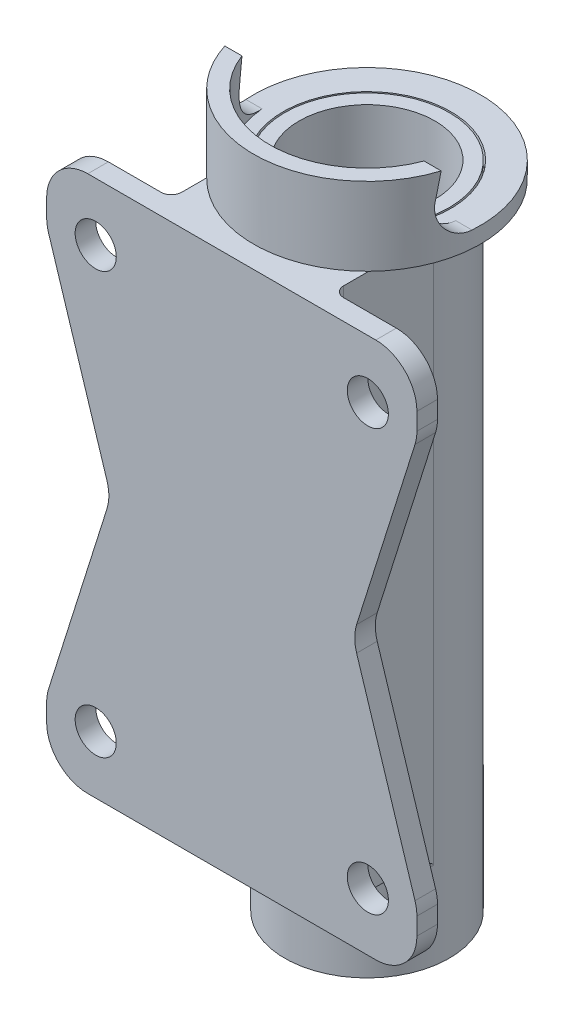
from build123d import *
from build123d.topology import SkipClean

# Parameters (mm, degrees)
BOSS_EXTRUDE1_DEPTH      = 3.175
BOSS_EXTRUDE4_START      = 150.025
BOSS_EXTRUDE4_DEPTH      = 150.025
BOSS_EXTRUDE5_START      = 3.175
BOSS_EXTRUDE5_DEPTH      = 3.175
SKETCH18_W               = 114.3
SKETCH18_H               = 173.2
BOSS_EXTRUDE6_DEPTH      = 6.35
BOSS_EXTRUDE9_DEPTH      = 1.5875
BOSS_EXTRUDE9_DEPTH_BACK = 1.5875
SKETCH26_R               = 35
SKETCH26_R_2             = 25.899999994
BOSS_EXTRUDE7_DEPTH      = 5
BOSS_EXTRUDE8_DEPTH      = 19.05
CUT_EXTRUDE3_DEPTH       = 231.866297886
CUT_EXTRUDE3_DEPTH_BACK  = 231.866297886
BOSS_EXTRUDE10_START     = 150.025
BOSS_EXTRUDE10_DEPTH     = 150.025
BOSS_EXTRUDE11_START     = 9.325
BOSS_EXTRUDE11_DEPTH     = 9.325
SKETCH36_W               = 6.35
SKETCH36_H               = 7.5
CUT_EXTRUDE4_DEPTH       = 252.192386516
FILLET1_R                = 3.175
CUT_EXTRUDE5_DEPTH       = 238.723253055
FILLET2_R                = 12.7
SKETCH38_R               = 6.35
CUT_EXTRUDE6_DEPTH       = 238.723253055
SKETCH41_R               = 25.399999994
CUT_EXTRUDE8_DEPTH       = 213.813709708


with BuildPart() as part:
    # Sketch12 → Revolve1 (revolve)
    with BuildSketch(Plane.XY, mode=Mode.PRIVATE) as revolve1_sk:
        Polygon((-25.399999994, 0), (-25.399999994, 203.2), (-20.955, 203.2), (-20.955, 165.1), (-19.177, 165.1), (-19.177, 38.1), (-20.955, 38.1), (-20.955, 0), align=None)
    revolve(revolve1_sk.sketch.rotate(Axis((0, 0, 0), (0, 1, 0)), 270), axis=Axis((0, 0, 0), (0, 1, 0)))



with BuildPart() as body_2:
    # Sketch14 → Boss-Extrude1 (new body)
    with BuildSketch(Plane(origin=(0, 30, 0), x_dir=(-1, 0, 0), z_dir=(0, -1, 0))):
        with BuildLine():
            Line((-25, -4.489988829), (-25, -35.399999994))
            Line((-25, -35.399999994), (25, -35.399999994))
            Line((25, -35.399999994), (25, -4.489988829))
            ThreePointArc((25, -4.489988829), (0, -25.399999994), (-25, -4.489988829))
        make_face()
    extrude(amount=-BOSS_EXTRUDE1_DEPTH)

    # Sketch15 → Boss-Extrude4 (add)
    with BuildSketch(Plane(origin=(0, 33.175, 0), x_dir=(1, 0, 0), z_dir=(0, 1, 0)).offset(BOSS_EXTRUDE4_START)):
        with BuildLine():
            Line((-1.5875, -25.350342077), (-1.5875, -35.399999994))
            Line((-1.5875, -35.399999994), (1.5875, -35.399999994))
            Line((1.5875, -35.399999994), (1.5875, -25.350342077))
            ThreePointArc((1.5875, -25.350342077), (0, -25.399999994), (-1.5875, -25.350342077))
        make_face()
    extrude(amount=-BOSS_EXTRUDE4_DEPTH)

    # Sketch17 → Boss-Extrude5 (add)
    with BuildSketch(Plane(origin=(0, 183.2, 0), x_dir=(1, 0, 0), z_dir=(0, 1, 0)).offset(BOSS_EXTRUDE5_START)):
        with BuildLine():
            Line((25, -35.399999994), (25, -4.489988829))
            ThreePointArc((25, -4.489988829), (0, -25.399999994), (-25, -4.489988829))
            Line((-25, -4.489988829), (-25, -35.399999994))
            Line((-25, -35.399999994), (25, -35.399999994))
        make_face()
    extrude(amount=-BOSS_EXTRUDE5_DEPTH)

    # Sketch18 → Boss-Extrude6 (add)
    with BuildSketch(Plane.XY.offset(35.399999994)):
        with Locations((0, 116.6)):
            Rectangle(SKETCH18_W, SKETCH18_H)
    extrude(amount=BOSS_EXTRUDE6_DEPTH)


with BuildPart() as part_1:
    add(part.part)

    add(body_2.part)  # Boss-Extrude9 merges body 2
    # Sketch30 → Boss-Extrude9 (add, two sides: drawn at the far end of the back side and taken through both)
    with BuildSketch(Plane(origin=(0, 106.6, 0), x_dir=(-1, 0, 0), z_dir=(0, -1, 0)).offset(-BOSS_EXTRUDE9_DEPTH_BACK)):
        with BuildLine():
            Line((25, -35.399999994), (25, -4.489988829))
            ThreePointArc((25, -4.489988829), (0, -25.399999994), (-25, -4.489988829))
            Line((-25, -4.489988829), (-25, -35.399999994))
            Line((-25, -35.399999994), (25, -35.399999994))
        make_face()
    extrude(amount=BOSS_EXTRUDE9_DEPTH + BOSS_EXTRUDE9_DEPTH_BACK)


with BuildPart() as body_2_2:
    # Sketch26 → Boss-Extrude7 (new body)
    with BuildSketch(Plane(origin=(0, 200.7, 0), x_dir=(1, 0, 0), z_dir=(0, 1, 0))):
        with Locations(Location((0, 0, 0), (0, 0, 270))):
            Circle(SKETCH26_R)
        with Locations(Location((0, 0, 0), (0, 0, 270))):
            Circle(SKETCH26_R_2, mode=Mode.SUBTRACT)
    extrude(amount=-BOSS_EXTRUDE7_DEPTH)

    # Sketch26<3> → Boss-Extrude8 (add)
    with SkipClean():  # the faces are left unmerged after this step: merging them gives an invalid solid
        with BuildSketch(Plane(origin=(0, 200.7, 0), x_dir=(1, 0, 0), z_dir=(0, 1, 0))):
            with BuildLine():
                ThreePointArc((-34.910600109, -2.5), (0, -35), (34.910600109, -2.5))
                Line((34.910600109, -2.5), (29.895651858, -2.5))
                ThreePointArc((29.895651858, -2.5), (0, -30), (-29.895651858, -2.5))
                Line((-29.895651858, -2.5), (-34.910600109, -2.5))
            make_face()
        extrude(amount=BOSS_EXTRUDE8_DEPTH)


with BuildPart() as cut_extrude3_tool:
    # Sketch33 → Cut-Extrude3 (new, two sides: drawn at the far end of the back side and taken through both)
    with SkipClean():  # the faces are left unmerged after this step: merging them gives an invalid solid
        with BuildSketch(Plane(origin=(0, 0, 0), x_dir=(0, 0, -1), z_dir=(1, 0, 0)).offset(-CUT_EXTRUDE3_DEPTH_BACK)):
            with BuildLine():
                Line((-2.5, 219.75), (-2.99214107, 219.75))
                Line((-2.99214107, 219.75), (-10.5, 219.75))
                Line((-10.5, 219.75), (-11.8865543, 211.886459809))
                ThreePointArc((-11.8865543, 211.886459809), (-9.801443088, 204.104718827), (-2.5, 200.7))
                Line((-2.5, 200.7), (-2.5, 219.75))
            make_face()
        extrude(amount=CUT_EXTRUDE3_DEPTH + CUT_EXTRUDE3_DEPTH_BACK)


with BuildPart() as part_2:
    with SkipClean():  # the faces are left unmerged after this step: merging them gives an invalid solid
        add(part_1.part)

        # Cut-Extrude3: cut by cut_extrude3_tool
        add(cut_extrude3_tool.part, mode=Mode.SUBTRACT)

    # Sketch34 → Boss-Extrude10 (add)
    with BuildSketch(Plane(origin=(0, 33.175, 0), x_dir=(1, 0, 0), z_dir=(0, 1, 0)).offset(BOSS_EXTRUDE10_START)):
        with BuildLine():
            Line((-25, -35.399999994), (-1.5875, -35.399999994))
            Line((-1.5875, -35.399999994), (-1.5875, -25.350342077))
            ThreePointArc((-1.5875, -25.350342077), (-16.897111394, -18.964377823), (-25, -4.489988829))
            Line((-25, -4.489988829), (-25, -35.399999994))
        make_face()
        with BuildLine():
            Line((1.5875, -25.350342077), (1.5875, -35.399999994))
            Line((1.5875, -35.399999994), (25, -35.399999994))
            Line((25, -35.399999994), (25, -4.489988829))
            ThreePointArc((25, -4.489988829), (16.897111394, -18.964377823), (1.5875, -25.350342077))
        make_face()
    extrude(amount=-BOSS_EXTRUDE10_DEPTH)



with BuildPart() as body_2_2_1:
    with SkipClean():  # the faces are left unmerged after this step: merging them gives an invalid solid
        add(body_2_2.part)

        # Cut-Extrude3: cut by cut_extrude3_tool
        add(cut_extrude3_tool.part, mode=Mode.SUBTRACT)


with BuildPart() as part_3:
    with SkipClean():  # the faces are left unmerged after this step: merging them gives an invalid solid
        add(part_2.part)

        add(body_2_2_1.part)  # Boss-Extrude11 merges body 2 2
        # Sketch35 → Boss-Extrude11 (add)
        with BuildSketch(Plane(origin=(0, 186.375, 0), x_dir=(1, 0, 0), z_dir=(0, 1, 0)).offset(BOSS_EXTRUDE11_START)):
            with BuildLine():
                Line((-25, -35.399999994), (25, -35.399999994))
                Line((25, -35.399999994), (25, -4.489988829))
                ThreePointArc((25, -4.489988829), (0, -25.399999994), (-25, -4.489988829))
                Line((-25, -4.489988829), (-25, -35.399999994))
            make_face()
        extrude(amount=-BOSS_EXTRUDE11_DEPTH)

    # Sketch36 → Cut-Extrude4 (cut, through all)
    with SkipClean():  # the faces are left unmerged after this step: merging them gives an invalid solid
        with BuildSketch(Plane(origin=(57.15, 0, 0), x_dir=(0, 0, -1), z_dir=(1, 0, 0))):
            with Locations((-38.574999994, 199.45)):
                Rectangle(SKETCH36_W, SKETCH36_H)
        extrude(amount=-CUT_EXTRUDE4_DEPTH, mode=Mode.SUBTRACT)

    # Fillet1
    fillet1_edges = [part_3.edges().sort_by_distance(p)[0] for p in [
        (-25, 112.85, 35.399999994),
        (25, 112.85, 35.399999994),
        (0, 30, 25.399999994),
    ]]
    fillet(fillet1_edges, radius=FILLET1_R)

    # Sketch37 → Cut-Extrude5 (cut, through all)
    with SkipClean():  # the faces are left unmerged after this step: merging them gives an invalid solid
        with BuildSketch(Plane(origin=(0, 0, 35.399999994), x_dir=(-1, 0, 0), z_dir=(0, 0, -1))):
            Polygon((-57.15, 175.7), (-37.333471119, 112.85), (-57.15, 50), align=None)
            Polygon((57.15, 50), (37.333471119, 112.85), (57.15, 175.7), align=None)
        extrude(amount=-CUT_EXTRUDE5_DEPTH, mode=Mode.SUBTRACT)

    # Fillet2
    fillet2_edges = [part_3.edges().sort_by_distance(p)[0] for p in [
        (-57.15, 195.7, 38.574999994),
        (57.15, 195.7, 38.574999994),
        (-57.15, 50, 38.574999994),
        (-37.333471119, 112.85, 38.574999994),
        (-57.15, 175.7, 38.574999994),
        (37.333471119, 112.85, 38.574999994),
        (57.15, 50, 38.574999994),
        (57.15, 175.7, 38.574999994),
        (-57.15, 30, 38.574999994),
        (57.15, 30, 38.574999994),
    ]]
    fillet(fillet2_edges, radius=FILLET2_R)

    # Sketch38 → Cut-Extrude6 (cut, through all)
    with SkipClean():  # the faces are left unmerged after this step: merging them gives an invalid solid
        with BuildSketch(Plane(origin=(0, 0, 35.399999994), x_dir=(-1, 0, 0), z_dir=(0, 0, -1))):
            with Locations((-42, 177.85)):
                Circle(SKETCH38_R)
            with Locations(Location((42, 177.85, 0), (0, 0, 180))):
                Circle(SKETCH38_R)
            with Locations((42, 47.85)):
                Circle(SKETCH38_R)
            with Locations(Location((-42, 47.85, 0), (0, 0, 180))):
                Circle(SKETCH38_R)
        extrude(amount=-CUT_EXTRUDE6_DEPTH, mode=Mode.SUBTRACT)

    # Sketch41 → Cut-Extrude8 (cut, through all)
    with SkipClean():  # the faces are left unmerged after this step: merging them gives an invalid solid
        with BuildSketch(Plane(origin=(0, 200.7, 0), x_dir=(1, 0, 0), z_dir=(0, 1, 0))):
            with Locations(Location((0, 0, 0), (0, 0, 90))):
                Circle(SKETCH41_R)
        extrude(amount=CUT_EXTRUDE8_DEPTH, mode=Mode.SUBTRACT)


solid = part_3.part
